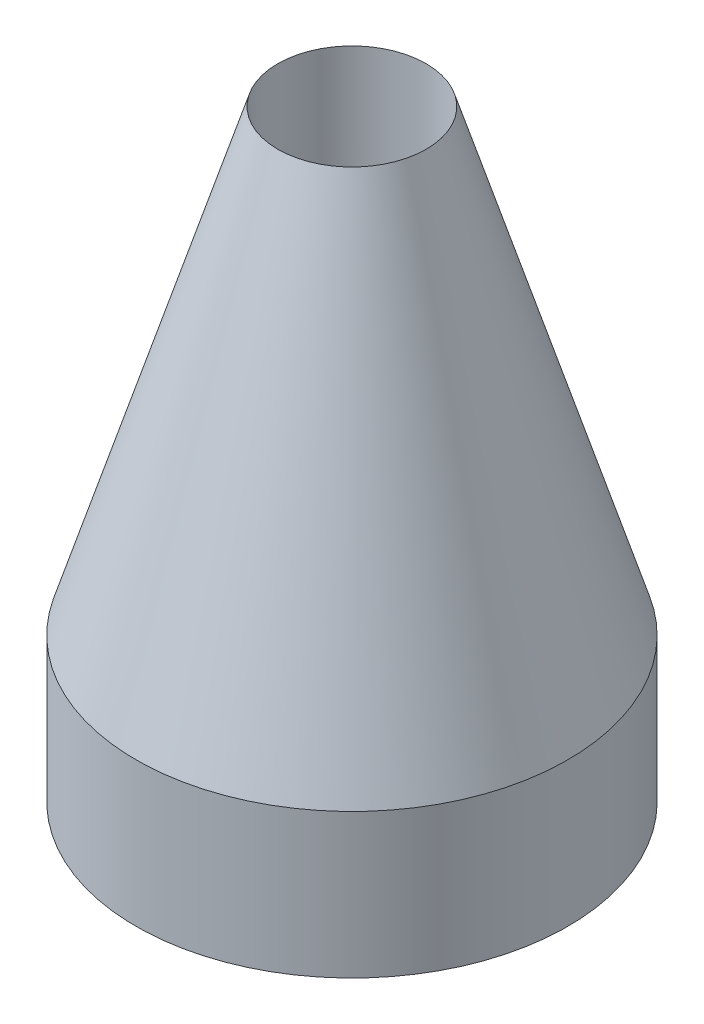
from build123d import *

# Parameters (mm, degrees)
SKETCH2_R          = 14.25
CUT_EXTRUDE1_DEPTH = 87.71


with BuildPart() as part:
    # Sketch1 → Revolve2 (revolve)
    with BuildSketch(Plane.XY, mode=Mode.PRIVATE) as revolve2_sk:
        Polygon((0, -29.426170213), (41.453508918, -29.426170213), (41.453508918, -1.716170213), (14.25, 86.253829787), (0, 86.253829787), align=None)
    revolve(revolve2_sk.sketch.rotate(Axis((0, -29.426170213, 0), (0, 1, 0)), 90), axis=Axis((0, -29.426170213, 0), (0, 1, 0)))

    # Sketch2 → Cut-Extrude1 (cut)
    with BuildSketch(Plane(origin=(0, 86.253829787, 0), x_dir=(1, 0, 0), z_dir=(0, 1, 0))):
        with Locations(Location((0, 0, 0), (0, 0, 270))):
            Circle(SKETCH2_R)
    extrude(amount=-CUT_EXTRUDE1_DEPTH, mode=Mode.SUBTRACT)


solid = part.part
